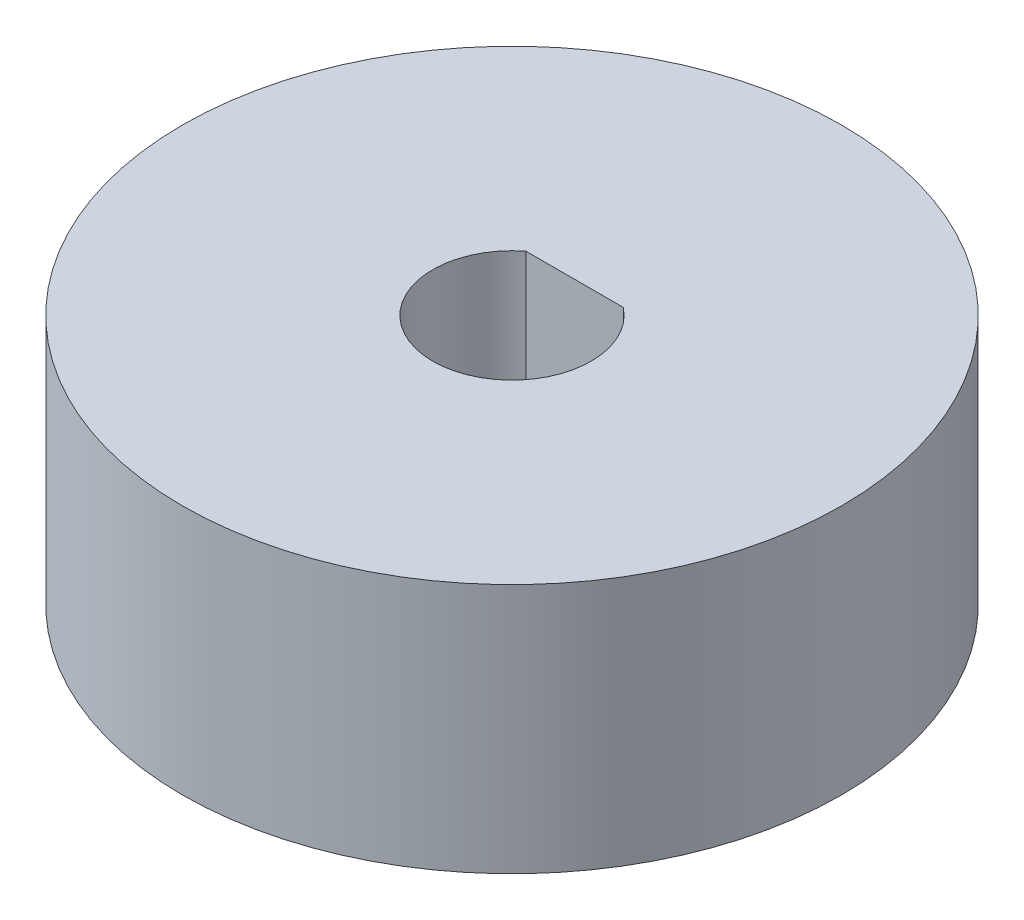
from build123d import *

# Parameters (mm, degrees)
SKETCH_1_R      = 7.9
EXTRUDE_3_DEPTH = 6


with BuildPart() as part:
    # 草图1 → 凸台-拉伸3 (new body)
    with BuildSketch(Plane(origin=(0, 0, 0), x_dir=(1, 0, 0), z_dir=(0, 1, 0))):
        with Locations(Location((0, 0, 0), (0, 0, 270))):
            Circle(SKETCH_1_R)
        with BuildLine():
            Line((-1.166190379, 1.5), (1.166190379, 1.5))
            ThreePointArc((1.166190379, 1.5), (1.797220076, -0.6164414), (0, -1.9))
            ThreePointArc((0, -1.9), (-1.797220076, -0.6164414), (-1.166190379, 1.5))
        make_face(mode=Mode.SUBTRACT)
    extrude(amount=EXTRUDE_3_DEPTH)


solid = part.part
